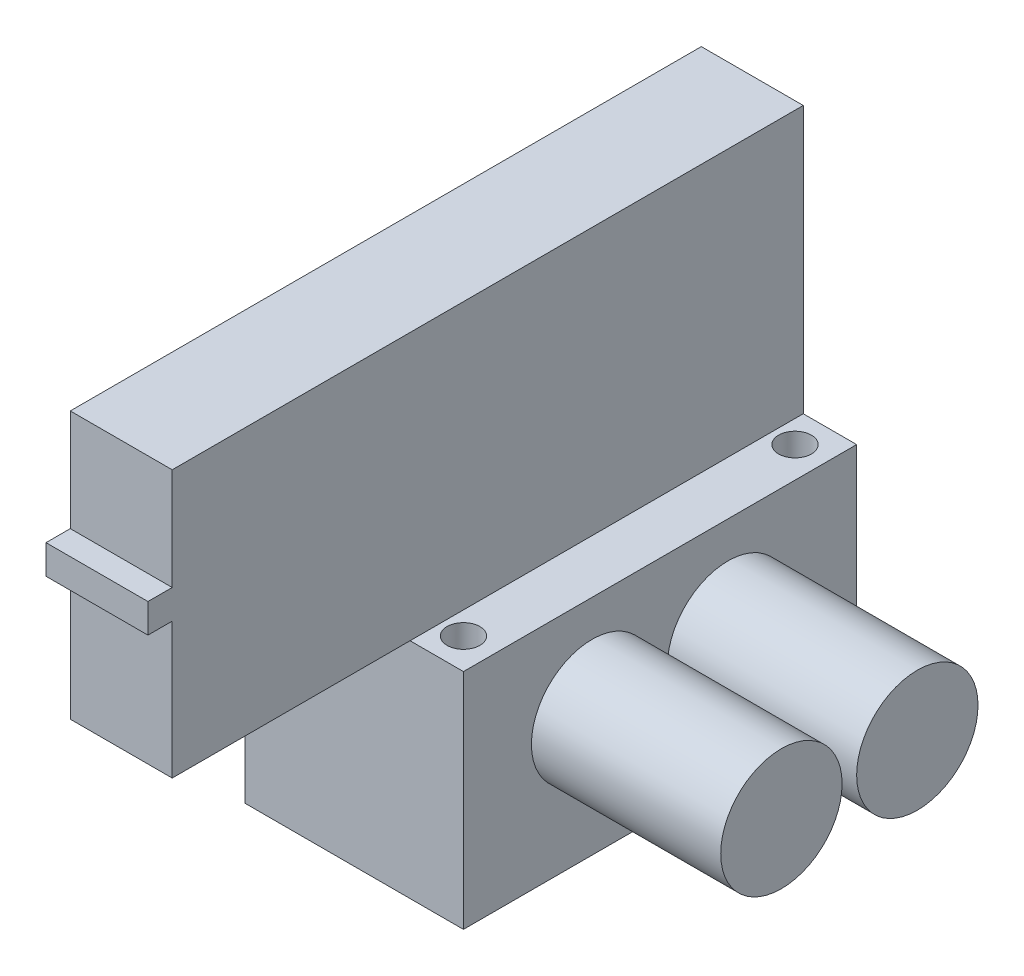
from build123d import *

# Parameters (mm, degrees)
SKETCH1_W           = 22.86
SKETCH1_H           = 41.148
BOSS_EXTRUDE1_DEPTH = 23.368
SKETCH2_W           = 10.668
SKETCH2_H           = 66.04
BOSS_EXTRUDE2_DEPTH = 27.94
SKETCH3_R           = 6.35
BOSS_EXTRUDE3_DEPTH = 19.812
SKETCH4_R           = 6.35
BOSS_EXTRUDE4_DEPTH = 19.812
SKETCH5_W           = 10.668
SKETCH5_H           = 3.048
BOSS_EXTRUDE5_DEPTH = 2.54
SKETCH6_R           = 1.7145
CUT_EXTRUDE1_DEPTH  = 79.400053265


with BuildPart() as part:
    # Sketch1 → Boss-Extrude1 (new body)
    with BuildSketch(Plane(origin=(0, 0, 0), x_dir=(1, 0, 0), z_dir=(0, 1, 0))):
        with Locations((11.43, 20.574)):
            Rectangle(SKETCH1_W, SKETCH1_H)
    extrude(amount=BOSS_EXTRUDE1_DEPTH)

    # Sketch2 → Boss-Extrude2 (add)
    with BuildSketch(Plane(origin=(0, 23.368, 0), x_dir=(1, 0, 0), z_dir=(0, 1, 0))):
        with Locations((11.938, 8.128)):
            Rectangle(SKETCH2_W, SKETCH2_H)
    extrude(amount=BOSS_EXTRUDE2_DEPTH)

    # Sketch3 → Boss-Extrude3 (add)
    with BuildSketch(Plane.ZY):
        with Locations(Location((-20.828, 16.256, 0), (0, 0, 180))):
            Circle(SKETCH3_R)
    extrude(amount=BOSS_EXTRUDE3_DEPTH)

    # Sketch4 → Boss-Extrude4 (add)
    with BuildSketch(Plane(origin=(22.86, 0, 0), x_dir=(0, 0, -1), z_dir=(1, 0, 0))):
        with Locations(Location((27.686, 13.208, 0), (0, 0, 180))):
            Circle(SKETCH4_R)
        with Locations(Location((13.462, 13.208, 0), (0, 0, 180))):
            Circle(SKETCH4_R)
    extrude(amount=BOSS_EXTRUDE4_DEPTH)

    # Sketch5 → Boss-Extrude5 (add)
    with BuildSketch(Plane.XY.offset(24.892)):
        with Locations((11.938, 39.116)):
            Rectangle(SKETCH5_W, SKETCH5_H)
    extrude(amount=BOSS_EXTRUDE5_DEPTH)

    # Sketch6 → Cut-Extrude1 (cut, through all)
    with BuildSketch(Plane(origin=(0, 0, 0), x_dir=(-1, 0, 0), z_dir=(0, -1, 0))):
        with Locations(Location((-19.6342, 3.2258, 0), (0, 0, 90))):
            Circle(SKETCH6_R)
        with Locations(Location((-19.6342, 37.9222, 0), (0, 0, 90))):
            Circle(SKETCH6_R)
    extrude(amount=-CUT_EXTRUDE1_DEPTH, mode=Mode.SUBTRACT)


solid = part.part
